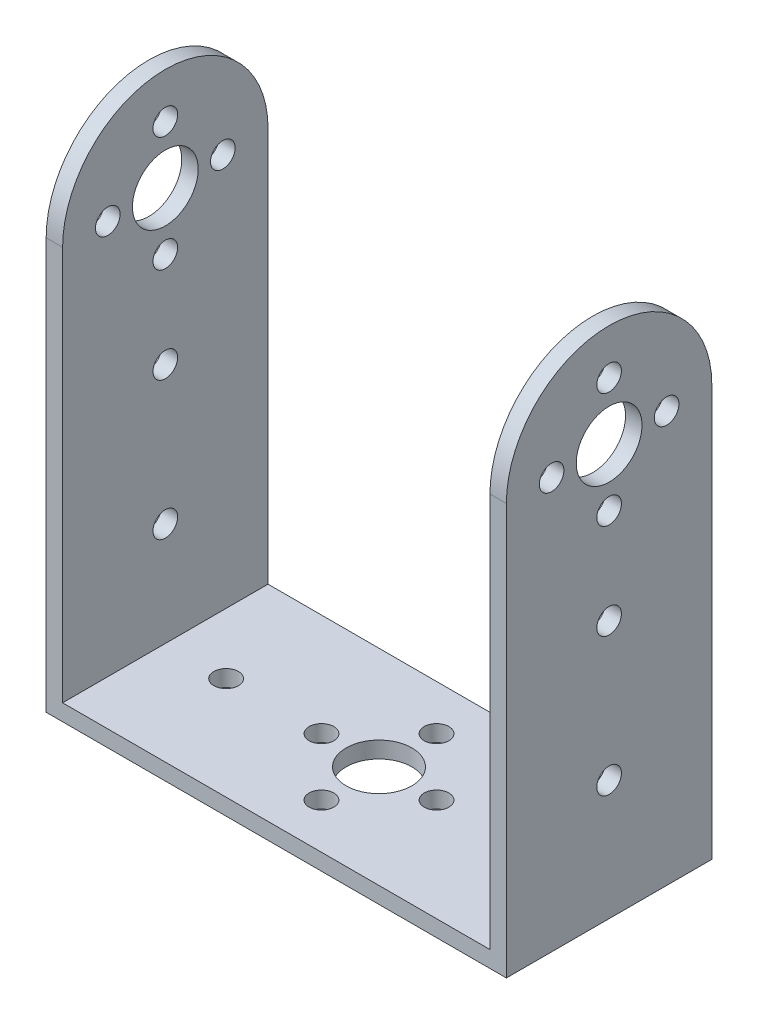
from build123d import *

# Parameters (mm, degrees)
EXTRUDE_1_DEPTH     = 25
SKETCH_3_R          = 4
SKETCH_3_R_2        = 1.5
CUT_EXTRUDE_1_DEPTH = 73.905761089
SKETCH_4_R          = 4
SKETCH_4_R_2        = 1.5
CUT_EXTRUDE_2_DEPTH = 88.562834582


with BuildPart() as part:
    # 草图2 → 凸台-拉伸1 (new body)
    with BuildSketch(Plane.XY):
        Polygon((0, 0), (-26, 0), (-26, 62.5), (-28, 62.5), (-28, -2), (28, -2), (28, 62.5), (26, 62.5), (26, 0), align=None)
    extrude(amount=EXTRUDE_1_DEPTH)

    # 草图3 → 切除-拉伸1 (cut, through all)
    with BuildSketch(Plane(origin=(0, 0, 0), x_dir=(1, 0, 0), z_dir=(0, 1, 0))):
        with Locations(Location((0, -12.5, 0), (0, 0, 180))):
            Circle(SKETCH_3_R)
        with Locations(Location((0, -5.5, 0), (0, 0, 180))):
            Circle(SKETCH_3_R_2)
        with Locations(Location((-18.6, -12.5, 0), (0, 0, 180))):
            Circle(SKETCH_3_R_2)
        with Locations((18.6, -12.5)):
            Circle(SKETCH_3_R_2)
        with Locations(Location((7, -12.5, 0), (0, 0, 180))):
            Circle(SKETCH_3_R_2)
        with Locations(Location((0, -19.5, 0), (0, 0, 180))):
            Circle(SKETCH_3_R_2)
        with Locations(Location((-7, -12.5, 0), (0, 0, 180))):
            Circle(SKETCH_3_R_2)
    extrude(amount=-CUT_EXTRUDE_1_DEPTH, mode=Mode.SUBTRACT)

    # 草图4 → 切除-拉伸2 (cut, through all)
    with BuildSketch(Plane(origin=(28, 0, 0), x_dir=(0, 0, -1), z_dir=(1, 0, 0))):
        with Locations(Location((-12.5, 48, 0), (0, 0, 90))):
            Circle(SKETCH_4_R)
        with Locations(Location((-12.5, 55, 0), (0, 0, 90))):
            Circle(SKETCH_4_R_2)
        with Locations(Location((-5.5, 48, 0), (0, 0, 90))):
            Circle(SKETCH_4_R_2)
        with Locations(Location((-12.5, 41, 0), (0, 0, 90))):
            Circle(SKETCH_4_R_2)
        with Locations(Location((-19.5, 48, 0), (0, 0, 90))):
            Circle(SKETCH_4_R_2)
        with Locations(Location((-12.5, 29.4, 0), (0, 0, 90))):
            Circle(SKETCH_4_R_2)
        with Locations(Location((-12.5, 12.6, 0), (0, 0, 90))):
            Circle(SKETCH_4_R_2)
        with BuildLine():
            Line((0, 48), (0, 62.5))
            Line((0, 62.5), (-25, 62.5))
            Line((-25, 62.5), (-25, 48))
            ThreePointArc((-25, 48), (-12.5, 60.5), (0, 48))
        make_face()
    extrude(amount=-CUT_EXTRUDE_2_DEPTH, mode=Mode.SUBTRACT)


solid = part.part
